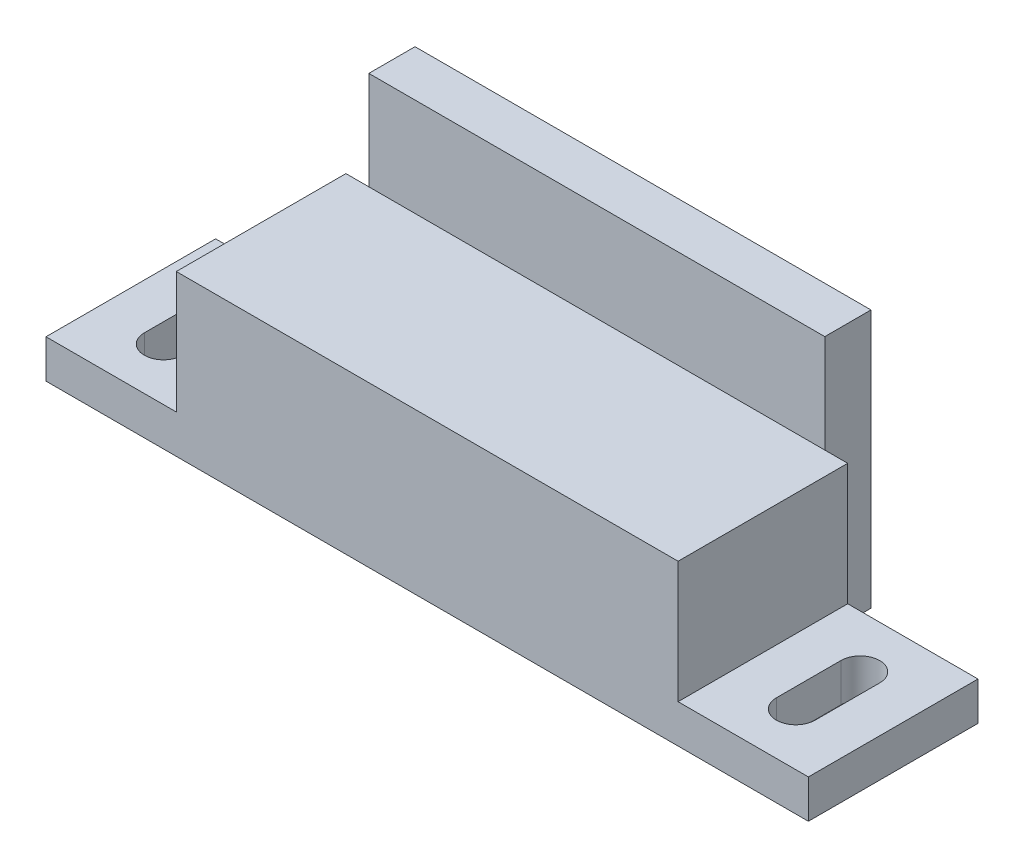
from build123d import *

# Parameters (mm, degrees)
BOSS_EXTRUDE1_DEPTH = 6.1087
CUT_EXTRUDE1_DEPTH  = 30.462097676
SKETCH3_W           = 32.8422
SKETCH3_H           = 18.608676988
BOSS_EXTRUDE2_DEPTH = 3.3274


with BuildPart() as part:
    # Sketch1 → Boss-Extrude1 (new, symmetric)
    with BuildSketch(Plane.XY):
        Polygon((-27.4574, 0), (27.4574, 0), (27.4574, 2.7686), (18.0721, 2.7686), (18.0721, 11.5316), (-18.0721, 11.5316), (-18.0721, 2.7686), (-27.4574, 2.7686), align=None)
    extrude(amount=BOSS_EXTRUDE1_DEPTH, both=True)

    # Sketch2 → Cut-Extrude1 (cut, through all)
    with BuildSketch(Plane(origin=(0, 2.7686, 0), x_dir=(1, 0, 0), z_dir=(0, 1, 0))):
        with BuildLine():
            Line((-21.36775, 2.3241), (-21.36775, -2.3241))
            ThreePointArc((-21.36775, -2.3241), (-22.76475, -3.7211), (-24.16175, -2.3241))
            Line((-24.16175, -2.3241), (-24.16175, 2.3241))
            ThreePointArc((-24.16175, 2.3241), (-22.76475, 3.7211), (-21.36775, 2.3241))
        make_face()
        with BuildLine():
            Line((21.36775, 2.3241), (21.36775, -2.3241))
            ThreePointArc((21.36775, -2.3241), (22.76475, -3.7211), (24.16175, -2.3241))
            Line((24.16175, -2.3241), (24.16175, 2.3241))
            ThreePointArc((24.16175, 2.3241), (22.76475, 3.7211), (21.36775, 2.3241))
        make_face()
    extrude(amount=-CUT_EXTRUDE1_DEPTH, mode=Mode.SUBTRACT)

    # Sketch3 → Boss-Extrude2 (add)
    with BuildSketch(Plane(origin=(0, 0, -6.1087), x_dir=(-1, 0, 0), z_dir=(0, 0, -1))):
        with Locations((0, 9.304338494)):
            Rectangle(SKETCH3_W, SKETCH3_H)
    extrude(amount=BOSS_EXTRUDE2_DEPTH)


solid = part.part
